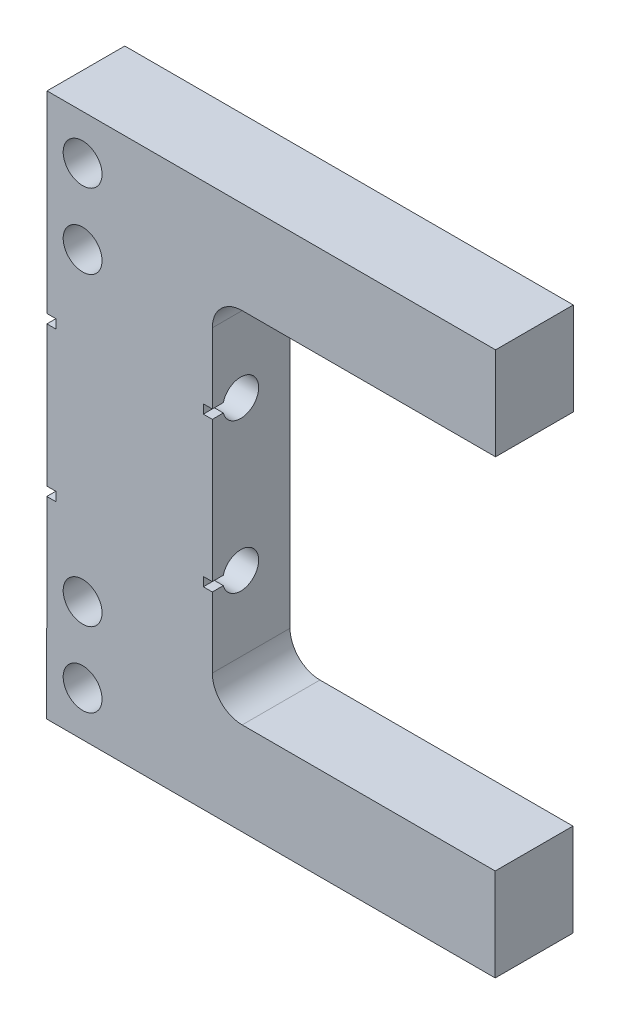
from build123d import *

# Parameters (mm, degrees)
EXTRUDE_1_DEPTH     = 2.6
SKETCH_2_R          = 0.65
CUT_EXTRUDE_1_DEPTH = 43.411489878
SKETCH_3_R          = 0.6
CUT_EXTRUDE_2_DEPTH = 43.675729829
SKETCH_5_W          = 0.4
SKETCH_5_H          = 0.3
CUT_EXTRUDE_3_DEPTH = 0.3
SKETCH_7_W          = 0.4
SKETCH_7_H          = 0.3
CUT_EXTRUDE_4_DEPTH = 0.3
FILLET_1_R          = 1


with BuildPart() as part:
    # 草圖1 → 填料-伸長1 (new body)
    with BuildSketch(Plane.XY):
        Polygon((6.798471119, 23.329620726), (6.798471119, 26.429618372), (-2.663246867, 26.429618372), (-2.663246867, 38.429618372), (6.810322616, 38.429618372), (6.810322616, 41.529620726), (-8.189677384, 41.529620726), (-8.201528881, 23.329620726), align=None)
    extrude(amount=EXTRUDE_1_DEPTH)

    # 草圖2 → 除料-伸長1 (cut, through all)
    with BuildSketch(Plane.XY.offset(2.6)):
        with Locations((-7.000552109, 24.829620726)):
            Circle(SKETCH_2_R)
        with Locations((-7.000552109, 27.329620726)):
            Circle(SKETCH_2_R)
        with Locations((-7.000552109, 40.029620726)):
            Circle(SKETCH_2_R)
        with Locations((-7.000552109, 37.529620726)):
            Circle(SKETCH_2_R)
    extrude(amount=-CUT_EXTRUDE_1_DEPTH, mode=Mode.SUBTRACT)

    # 草圖3 → 除料-伸長2 (cut, through all)
    with BuildSketch(Plane(origin=(-2.663246867, 0, 0), x_dir=(0, 0, -1), z_dir=(1, 0, 0))):
        with Locations(Location((-1.65, 34.929620726, 0), (0, 0, 90))):
            Circle(SKETCH_3_R)
        with Locations(Location((-1.65, 29.929620726, 0), (0, 0, 90))):
            Circle(SKETCH_3_R)
    extrude(amount=-CUT_EXTRUDE_2_DEPTH, mode=Mode.SUBTRACT)

    # 草圖5 → 除料-伸長3 (cut)
    with BuildSketch(Plane(origin=(-8.216717207, 0.005350572, 0), x_dir=(0, 0, 1), z_dir=(-0.9999997879816068, 0.0006511810359147792, 0))):
        with Locations((2.4, 34.924278959)):
            Rectangle(SKETCH_5_W, SKETCH_5_H)
        with Locations((2.4, 29.924278959)):
            Rectangle(SKETCH_5_W, SKETCH_5_H)
    extrude(amount=-CUT_EXTRUDE_3_DEPTH, mode=Mode.SUBTRACT)

    # 草圖7 → 除料-伸長4 (cut)
    with BuildSketch(Plane(origin=(-2.663246867, 0, 0), x_dir=(0, 0, -1), z_dir=(1, 0, 0))):
        with Locations((-2.4, 29.929620726)):
            Rectangle(SKETCH_7_W, SKETCH_7_H)
        with Locations((-2.4, 34.929620726)):
            Rectangle(SKETCH_7_W, SKETCH_7_H)
    extrude(amount=-CUT_EXTRUDE_4_DEPTH, mode=Mode.SUBTRACT)

    # 圓角1
    fillet_1_edges = [part.edges().sort_by_distance(p)[0] for p in [
        (-2.663246867, 38.429618372, 1.3),
        (-2.663246867, 26.429618372, 1.3),
    ]]
    fillet(fillet_1_edges, radius=FILLET_1_R)


solid = part.part
